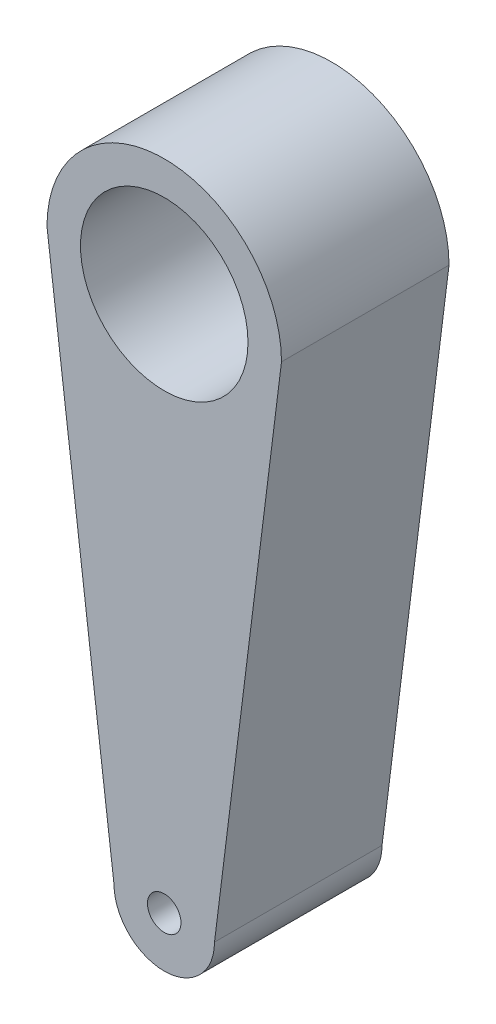
from build123d import *

# Parameters (mm, degrees)
CROQUIS1_R              = 2.5
CROQUIS1_R_2            = 0.5
SALIENTE_EXTRUIR1_DEPTH = 5


with BuildPart() as part:
    # Croquis1 → Saliente-Extruir1 (new body)
    with BuildSketch(Plane.XY):
        with BuildLine():
            Line((-3.5, 0), (-1.5, -16))
            ThreePointArc((-1.5, -16), (0, -17.5), (1.5, -16))
            Line((1.5, -16), (3.5, 0))
            ThreePointArc((3.5, 0), (0, 3.5), (-3.5, 0))
        make_face()
        Circle(CROQUIS1_R, mode=Mode.SUBTRACT)
        with Locations((0, -16)):
            Circle(CROQUIS1_R_2, mode=Mode.SUBTRACT)
    extrude(amount=SALIENTE_EXTRUIR1_DEPTH)


solid = part.part
